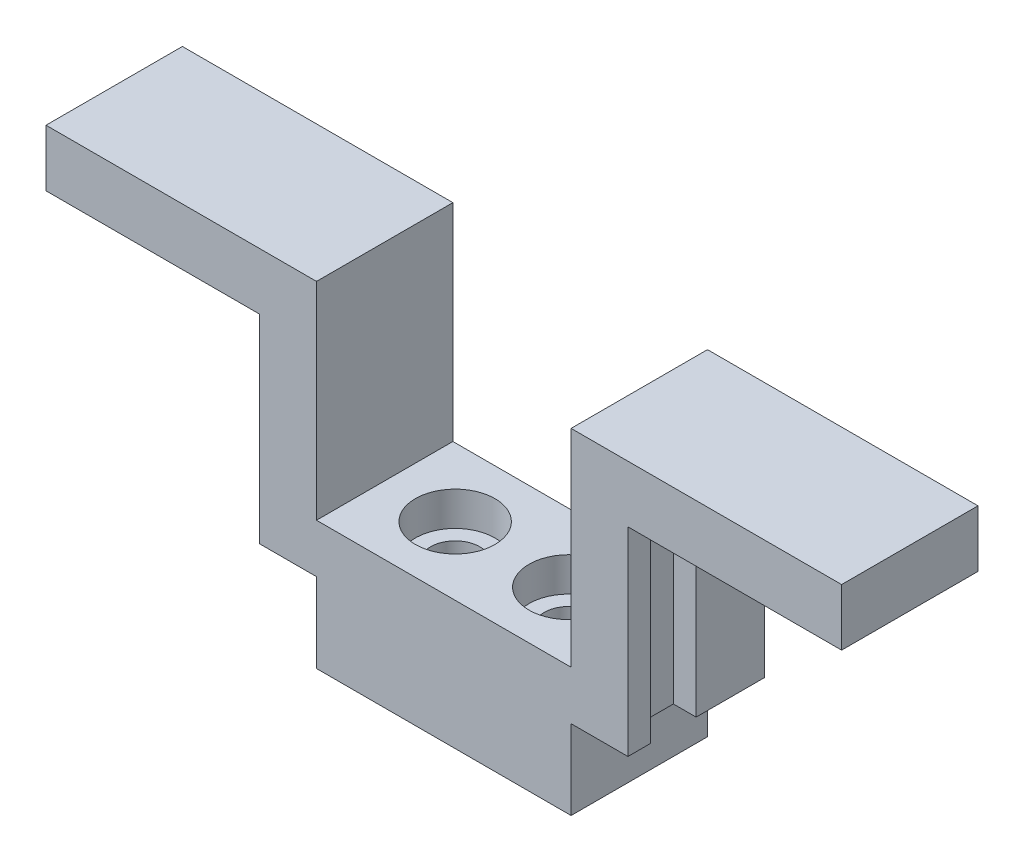
from build123d import *

# Parameters (mm, degrees)
BOSS_EXTRUDE2_DEPTH = 12
SKETCH3_W           = 4
SKETCH3_H           = 17.5
CUT_EXTRUDE1_DEPTH  = 2
SKETCH4_W           = 12
SKETCH4_H           = 11.3
BOSS_EXTRUDE3_DEPTH = 11.2
SKETCH5_R           = 3.5
CUT_EXTRUDE2_DEPTH  = 3
SKETCH6_R           = 2.165
CUT_EXTRUDE3_DEPTH  = 53.229110657


with BuildPart() as part:
    # Sketch2 → Boss-Extrude2 (new body)
    with BuildSketch(Plane.XY):
        Polygon((0, 0), (5, 0), (5, 17.5), (23.8, 17.5), (23.8, 22.5), (0, 22.5), (0, 17.5), align=None)
    boss_extrude2 = extrude(amount=BOSS_EXTRUDE2_DEPTH)

    # Sketch3 → Cut-Extrude1 (cut)
    with BuildSketch(Plane(origin=(5, 0, 0), x_dir=(0, 0, -1), z_dir=(1, 0, 0))):
        with Locations((-8, 8.75)):
            Rectangle(SKETCH3_W, SKETCH3_H)
    cut_extrude1 = extrude(amount=-CUT_EXTRUDE1_DEPTH, mode=Mode.SUBTRACT)

    # Sketch4 → Boss-Extrude3 (add)
    with BuildSketch(Plane.ZY):
        with Locations((6, -1.35)):
            Rectangle(SKETCH4_W, SKETCH4_H)
    boss_extrude3 = extrude(amount=BOSS_EXTRUDE3_DEPTH)

    # Mirror4: Boss-Extrude3 across plane
    add(boss_extrude3.mirror(Plane.ZY.offset(11.2)))

    # Mirror5: Boss-Extrude2 across plane
    add(boss_extrude2.mirror(Plane.ZY.offset(11.2)))

    # Mirror6: Cut-Extrude1 across plane
    add(cut_extrude1.mirror(Plane.ZY.offset(11.2)), mode=Mode.SUBTRACT)

    # Sketch5 → Cut-Extrude2 (cut)
    with BuildSketch(Plane(origin=(0, 4.3, 0), x_dir=(1, 0, 0), z_dir=(0, 1, 0))):
        with Locations(Location((-16.2, -6, 0), (0, 0, 270))):
            Circle(SKETCH5_R)
        with Locations(Location((-6.2, -6, 0), (0, 0, 270))):
            Circle(SKETCH5_R)
    extrude(amount=-CUT_EXTRUDE2_DEPTH, mode=Mode.SUBTRACT)

    # Sketch6 → Cut-Extrude3 (cut, through all)
    with BuildSketch(Plane(origin=(0, 1.3, 0), x_dir=(1, 0, 0), z_dir=(0, 1, 0))):
        with Locations(Location((-16.2, -6, 0), (0, 0, 270))):
            Circle(SKETCH6_R)
        with Locations(Location((-6.2, -6, 0), (0, 0, 270))):
            Circle(SKETCH6_R)
    extrude(amount=-CUT_EXTRUDE3_DEPTH, mode=Mode.SUBTRACT)


solid = part.part
